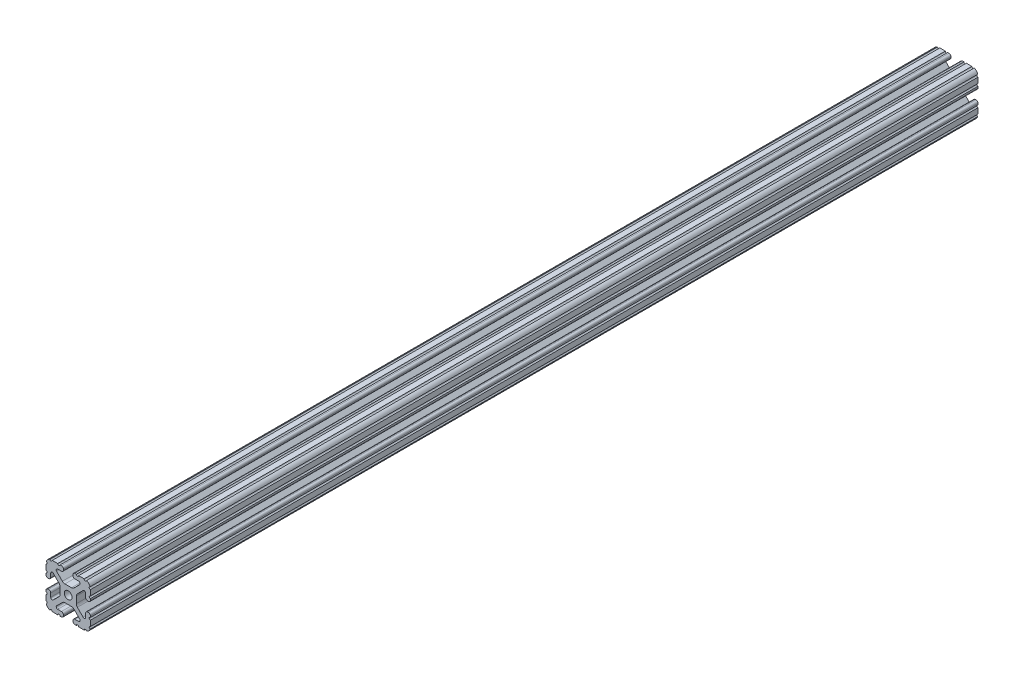
from build123d import *

# Parameters (mm, degrees)
BOSS_EXTRUDE1_DEPTH     = 381
CUT_EXTRUDE1_DEPTH      = 382.951312342
CUT_EXTRUDE1_DEPTH_BACK = 382.951312342
SKETCH5_R               = 1.016


with BuildPart() as part:
    # Sketch4 → Boss-Extrude1 (new, symmetric)
    with BuildSketch(Plane.XY):
        with BuildLine():
            Line((5.7912, -19.05), (14.3002, -19.05))
            ThreePointArc((14.3002, -19.05), (17.658815789, -17.658815789), (19.05, -14.3002))
            Line((19.05, -14.3002), (19.05, -5.7912))
            ThreePointArc((19.05, -5.7912), (18.544114832, -4.569885168), (17.3228, -4.064))
            Line((17.3228, -4.064), (16.7132, -4.064))
            ThreePointArc((16.7132, -4.064), (15.491885168, -4.569885168), (14.986, -5.7912))
            Line((14.986, -5.7912), (14.986, -8.996305235))
            ThreePointArc((14.986, -8.996305235), (14.189232738, -10.188751711), (12.782646215, -9.908964256))
            Line((12.782646215, -9.908964256), (7.888897763, -5.015215804))
            ThreePointArc((7.888897763, -5.015215804), (7.219915375, -4.014012907), (6.985, -2.833013566))
            Line((6.985, -2.833013566), (6.985, 0))
            Line((6.985, 0), (3.3274, 0))
            ThreePointArc((3.3274, 0), (2.352827104, -2.352827104), (0, -3.3274))
            Line((0, -3.3274), (0, -6.985))
            Line((0, -6.985), (2.833013566, -6.985))
            ThreePointArc((2.833013566, -6.985), (4.014012907, -7.219915375), (5.015215804, -7.888897763))
            Line((5.015215804, -7.888897763), (9.908964256, -12.782646215))
            ThreePointArc((9.908964256, -12.782646215), (10.188751711, -14.189232738), (8.996305235, -14.986))
            Line((8.996305235, -14.986), (5.7912, -14.986))
            ThreePointArc((5.7912, -14.986), (4.569885168, -15.491885168), (4.064, -16.7132))
            Line((4.064, -16.7132), (4.064, -17.3228))
            ThreePointArc((4.064, -17.3228), (4.569885168, -18.544114832), (5.7912, -19.05))
        make_face()
    extrude(amount=BOSS_EXTRUDE1_DEPTH, both=True)

    # Sketch5 → Cut-Extrude1 (cut, two sides: drawn at the far end of the back side and taken through both)
    with BuildSketch(Plane.XY.offset(-CUT_EXTRUDE1_DEPTH_BACK)):
        with Locations((14.739477062, -19.05)):
            Circle(SKETCH5_R)
        with Locations((7.980305235, -19.05)):
            Circle(SKETCH5_R)
        with Locations((19.05, -14.739477062)):
            Circle(SKETCH5_R)
        with Locations((19.05, -7.980305235)):
            Circle(SKETCH5_R)
    extrude(amount=CUT_EXTRUDE1_DEPTH + CUT_EXTRUDE1_DEPTH_BACK, mode=Mode.SUBTRACT)

    # Mirror1: part across plane


with BuildPart() as part_1:
    add(part.part)
    add(part.part.mirror(Plane(origin=(0, 0, 0), x_dir=(0, 0, 1), z_dir=(1, 0, 0))))

    # Mirror2: part across plane


with BuildPart() as part_2:
    add(part_1.part)
    add(part_1.part.mirror(Plane.ZX))


solid = part_2.part
